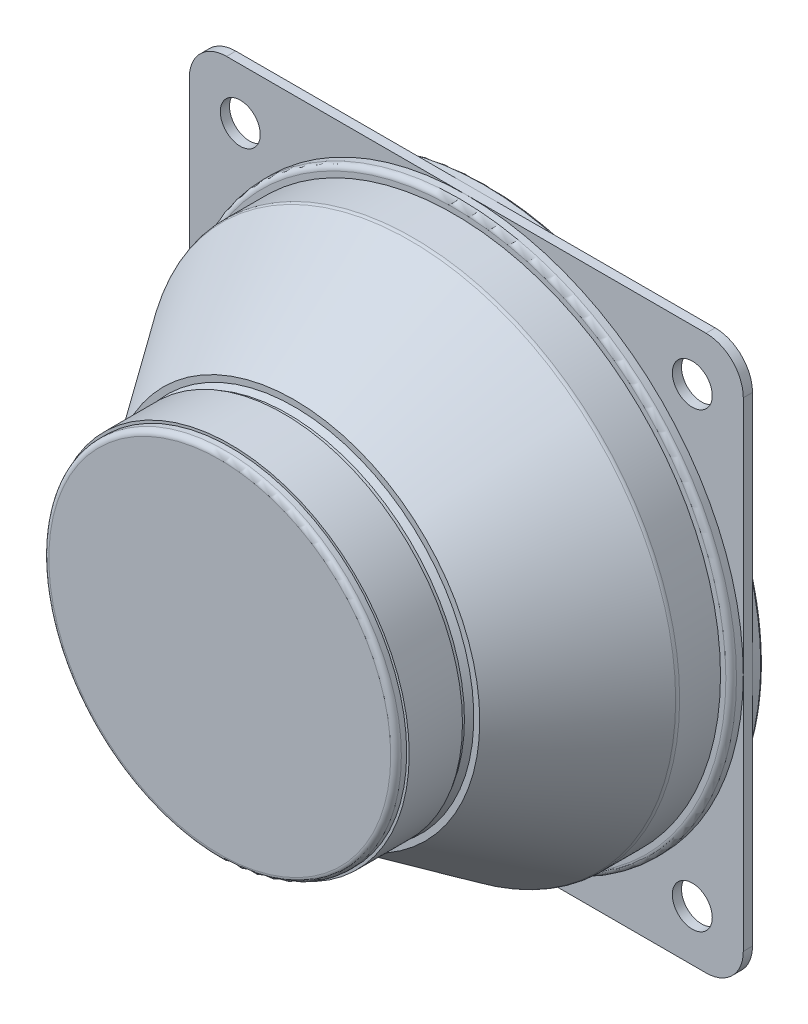
from build123d import *

# Parameters (mm, degrees)
SKETCH1_R           = 1.8750000000000036
BOSS_EXTRUDE1_DEPTH = 0.8636
FILLET1_R           = 0.5


with BuildPart() as part:
    # Sketch1 → Boss-Extrude1 (new body)
    with BuildSketch(Plane.XY):
        with BuildLine():
            Line((22.49999999999997, -26), (-22.499999999999975, -26.000000000000004))
            ThreePointArc((-22.499999999999975, -26.000000000000004), (-24.974873734152915, -24.97487373415292), (-26, -22.49999999999998))
            Line((-26, -22.49999999999998), (-26, 22.49999999999997))
            ThreePointArc((-26, 22.49999999999997), (-24.974873734152915, 24.97487373415291), (-22.499999999999975, 25.999999999999996))
            Line((-22.499999999999975, 25.999999999999996), (22.499999999999975, 26))
            ThreePointArc((22.499999999999975, 26), (24.974873734152915, 24.974873734152915), (26, 22.499999999999975))
            Line((26, 22.499999999999975), (25.999999999999996, -22.499999999999975))
            ThreePointArc((25.999999999999996, -22.499999999999975), (24.97487373415291, -24.974873734152915), (22.49999999999997, -26))
        make_face()
        with Locations((-21.213203435596427, 21.21320343559642)):
            Circle(SKETCH1_R, mode=Mode.SUBTRACT)
        with Locations(Location((21.213203435596427, 21.21320343559642, 0), (0, 0, 180))):
            Circle(SKETCH1_R, mode=Mode.SUBTRACT)
        with Locations(Location((-21.213203435596427, -21.21320343559642, 0), (0, 0, 180))):
            Circle(SKETCH1_R, mode=Mode.SUBTRACT)
        with Locations((21.213203435596427, -21.21320343559642)):
            Circle(SKETCH1_R, mode=Mode.SUBTRACT)
    extrude(amount=BOSS_EXTRUDE1_DEPTH)

    # Sketch4 → Revolve1 (revolve)
    with BuildSketch(Plane(origin=(0, 0, 0), x_dir=(0, 0, -1), z_dir=(1, 0, 0)), mode=Mode.PRIVATE) as revolve1_sk:
        Polygon((-0.8636, -26), (-0.8636, 0), (-24, -2.94e-15), (-24, -16.545489284823752), (-23, -16.545489284823752), (-23, -16.781378729014488), (-18, -16.781378729014484), (-18, -16.548074110049598), (-17.58494072823025, -16.548074110049598), (-17.58494072823025, -16.43860058443829), (-16.999999999999993, -16.84240458428251), (-16.999999999999993, -17.401925043942242), (-5.993612000725398, -24.999999999999996), (-2, -24.999999999999996), (-2, -26), align=None)
    revolve(revolve1_sk.sketch.rotate(Axis((0, 0, 0), (0, 0, 1)), 270), axis=Axis((0, 0, 0), (0, 0, 1)))

    # Sweep2: sweep along a path in Sketch5
    with BuildLine(Plane(origin=(0, 0, 0), x_dir=(-1, 0, 0), z_dir=(0, 0, -1))) as sweep2_path:
        CenterArc((0, 0), 26, 0, 360)
    # Sketch6 → Sweep2 (sweep)
    with BuildSketch(Plane(origin=(0, 0, 0), x_dir=(1, 0, 0), z_dir=(0, 1, 0))):
        with BuildLine():
            Line((-26, 0), (-24.896593131359168, 0))
            Line((-24.896593131359168, 0), (-24.896593131359168, 0.9232751750687385))
            Line((-24.896593131359168, 0.9232751750687385), (-25.849999999999998, 0.9232751750687386))
            ThreePointArc((-25.849999999999998, 0.9232751750687386), (-25.95606601717798, 0.8793411922467222), (-26, 0.7732751750687386))
            Line((-26, 0.7732751750687386), (-26, 0))
        make_face()
    sweep(path=sweep2_path.line)

    # Sketch7 → Cut-Revolve1 (revolve, cut)
    with BuildSketch(Plane(origin=(0, 0, 0), x_dir=(1, 0, 0), z_dir=(0, 1, 0))):
        with BuildLine():
            Line((-24.896593131359168, 0), (-24.896593131359168, 0.9232751750687385))
            Line((-24.896593131359168, 0.9232751750687385), (0, 0.9232751750687385))
            Line((0, 0.9232751750687385), (-6.94e-15, -5.993612000725398))
            ThreePointArc((-6.94e-15, -5.993612000725398), (-10.151260073303664, -5.048579342585647), (-19.953632182201776, -2.24596113107406))
            ThreePointArc((-19.953632182201776, -2.24596113107406), (-21.819172307480155, 0.21058636163321953), (-24.896593131359168, 0))
        make_face()
    revolve(axis=Axis((0, 0, -0.9232751750687385), (0, 0, 1)), mode=Mode.SUBTRACT)

    # Sketch8 → Revolve2 (revolve)
    with BuildSketch(Plane(origin=(0, 0, 0), x_dir=(1, 0, 0), z_dir=(0, 1, 0))):
        with BuildLine():
            Line((-19.953632182201776, -2.24596113107406), (-24.896593131359168, 0))
            ThreePointArc((-24.896593131359168, 0), (-21.819172307480155, 0.21058636163322175), (-19.953632182201776, -2.24596113107406))
        make_face()
    revolve(axis=Axis((-6.94e-15, 0, 5.993612000725398), (1e-15, 0, -1)))

    # Fillet1
    fillet1_edges = [part.edges().sort_by_distance(p)[0] for p in [
        (16.545489284823752, -5.7e-15, 24),
        (24.999999999999996, -8.61e-15, 5.993612000725398),
        (26, 2.59e-15, 2),
    ]]
    fillet(fillet1_edges, radius=FILLET1_R)


solid = part.part
